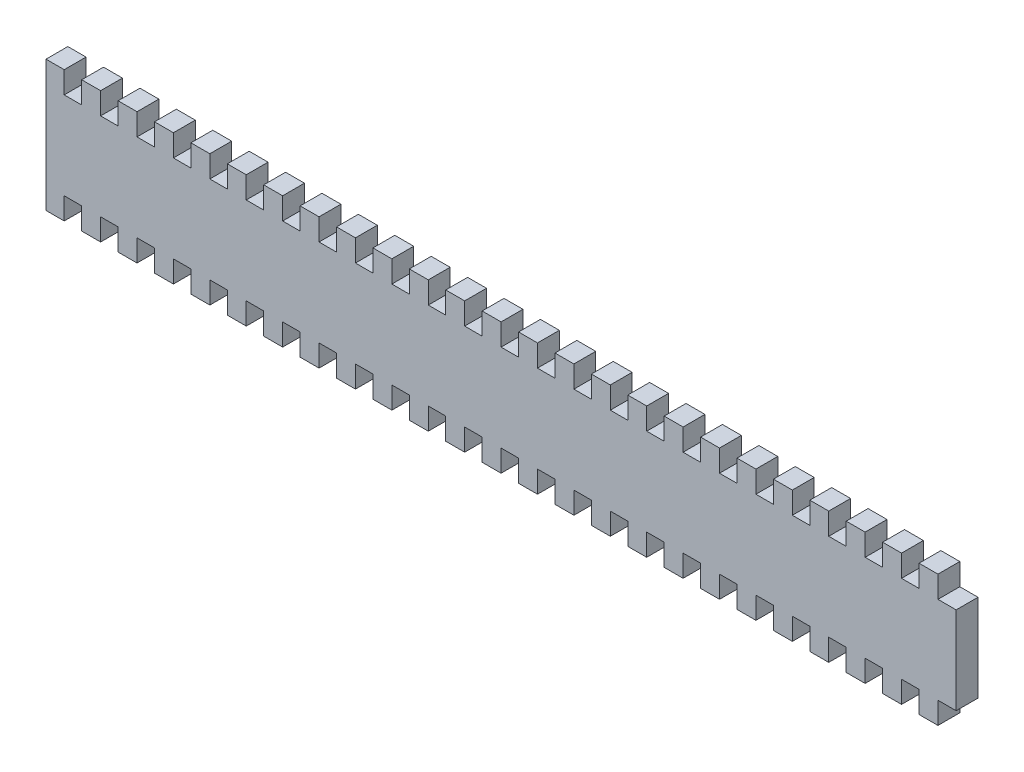
from build123d import *

# Parameters (mm, degrees)
BOSS_EXTRU_1_DEPTH      = 6
ESQUISSE2_W             = 0.2
ESQUISSE2_H             = 36
ENL_V_MAT_EXTRU_1_DEPTH = 10
ESQUISSE3_W             = 0.2
ESQUISSE3_H             = 24
BOSS_EXTRU_2_DEPTH      = 6


with BuildPart() as part:
    # Esquisse1 → Boss.-Extru.1 (new body)
    with BuildSketch(Plane.XY):
        Polygon((0, -18), (0, 18), (5.2, 18), (5.2, 12), (10, 12), (10, 18), (15.2, 18), (15.2, 12), (20, 12), (20, 18), (25.2, 18), (25.2, 12), (30, 12), (30, 18), (35.2, 18), (35.2, 12), (40, 12), (40, 18), (45.2, 18), (45.2, 12), (50, 12), (50, 18), (55.2, 18), (55.2, 12), (60, 12), (60, 18), (65.2, 18), (65.2, 12), (70, 12), (70, 18), (75.2, 18), (75.2, 12), (80, 12), (80, 18), (85.2, 18), (85.2, 12), (90, 12), (90, 18), (95.2, 18), (95.2, 12), (100, 12), (100, 18), (105.2, 18), (105.2, 12), (110, 12), (110, 18), (115.2, 18), (115.2, 12), (120, 12), (120, 18), (125.2, 18), (125.2, 12), (130, 12), (130, 18), (135.2, 18), (135.2, 12), (140, 12), (140, 18), (145.2, 18), (145.2, 12), (150, 12), (150, 18), (155.2, 18), (155.2, 12), (160, 12), (160, 18), (165.2, 18), (165.2, 12), (170, 12), (170, 18), (175.2, 18), (175.2, 12), (180, 12), (180, 18), (185.2, 18), (185.2, 12), (190, 12), (190, 18), (195.2, 18), (195.2, 12), (200, 12), (200, 18), (205.2, 18), (205.2, 12), (210, 12), (210, 18), (215.2, 18), (215.2, 12), (220, 12), (220, 18), (225.2, 18), (225.2, 12), (230, 12), (230, 18), (235.2, 18), (235.2, 12), (240, 12), (240, 18), (245.2, 18), (245.2, 12), (250, 12), (250, -12), (245.2, -12), (245.2, -18), (240, -18), (240, -12), (235.2, -12), (235.2, -18), (230, -18), (230, -12), (225.2, -12), (225.2, -18), (220, -18), (220, -12), (215.2, -12), (215.2, -18), (210, -18), (210, -12), (205.2, -12), (205.2, -18), (200, -18), (200, -12), (195.2, -12), (195.2, -18), (190, -18), (190, -12), (185.2, -12), (185.2, -18), (180, -18), (180, -12), (175.2, -12), (175.2, -18), (170, -18), (170, -12), (165.2, -12), (165.2, -18), (160, -18), (160, -12), (155.2, -12), (155.2, -18), (150, -18), (150, -12), (145.2, -12), (145.2, -18), (140, -18), (140, -12), (135.2, -12), (135.2, -18), (130, -18), (130, -12), (125.2, -12), (125.2, -18), (120, -18), (120, -12), (115.2, -12), (115.2, -18), (110, -18), (110, -12), (105.2, -12), (105.2, -18), (100, -18), (100, -12), (95.2, -12), (95.2, -18), (90, -18), (90, -12), (85.2, -12), (85.2, -18), (80, -18), (80, -12), (75.2, -12), (75.2, -18), (70, -18), (70, -12), (65.2, -12), (65.2, -18), (60, -18), (60, -12), (55.2, -12), (55.2, -18), (50, -18), (50, -12), (45.2, -12), (45.2, -18), (40, -18), (40, -12), (35.2, -12), (35.2, -18), (30, -18), (30, -12), (25.2, -12), (25.2, -18), (20, -18), (20, -12), (15.2, -12), (15.2, -18), (10, -18), (10, -12), (5.2, -12), (5.2, -18), align=None)
    extrude(amount=BOSS_EXTRU_1_DEPTH)

    # Esquisse2 → Enlèv. mat.-Extru.1 (cut)
    with BuildSketch(Plane.XY.offset(6)):
        with Locations((0.1, 0)):
            Rectangle(ESQUISSE2_W, ESQUISSE2_H)
    extrude(amount=-ENL_V_MAT_EXTRU_1_DEPTH, mode=Mode.SUBTRACT)

    # Esquisse3 → Boss.-Extru.2 (add)
    with BuildSketch(Plane.XY.offset(6)):
        with Locations((250.1, 0)):
            Rectangle(ESQUISSE3_W, ESQUISSE3_H)
    extrude(amount=-BOSS_EXTRU_2_DEPTH)


solid = part.part
